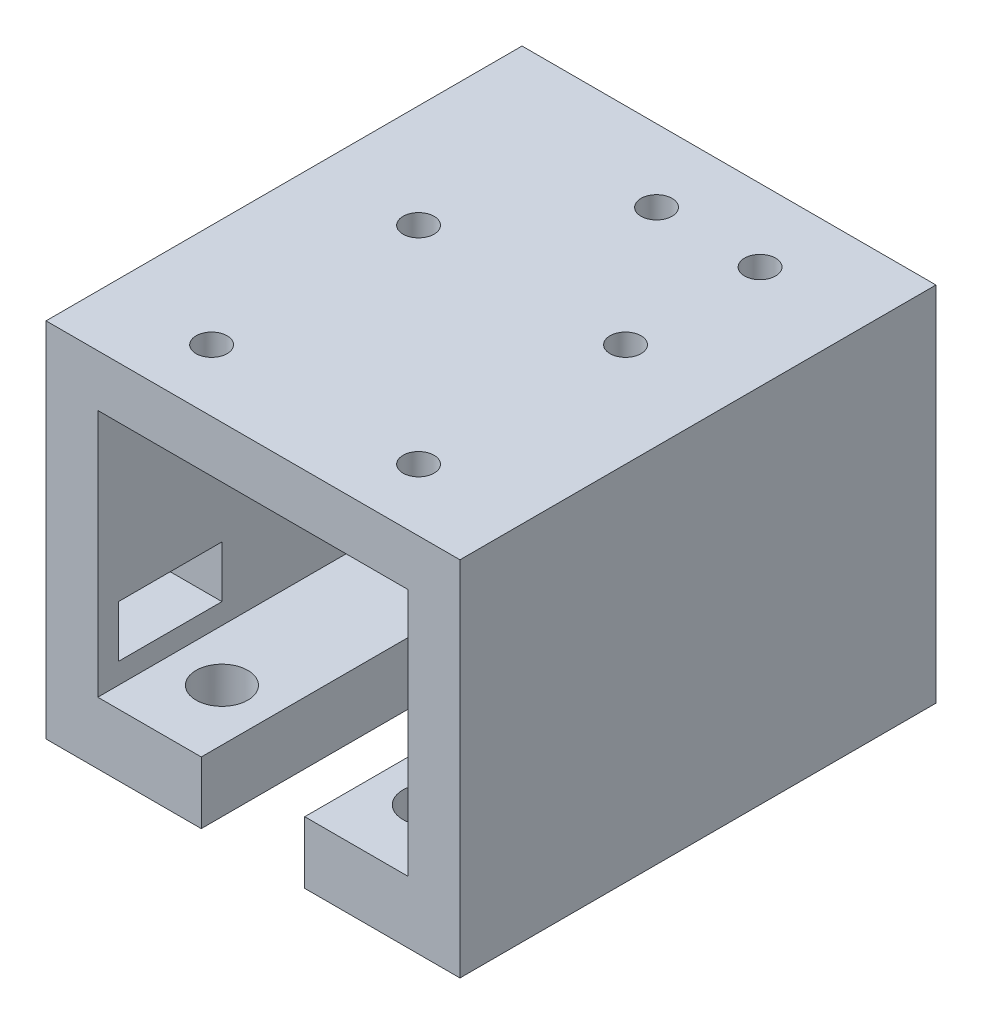
from build123d import *

# Parameters (mm, degrees)
BOSS_EXTRUDE1_DEPTH = 46
SKETCH2_R           = 2.5
CUT_EXTRUDE1_DEPTH  = 6
SKETCH3_R           = 1.5
CUT_EXTRUDE2_DEPTH  = 5
SKETCH4_R           = 1.5
CUT_EXTRUDE3_DEPTH  = 5
SKETCH5_W           = 10
SKETCH5_H           = 5
CUT_EXTRUDE4_DEPTH  = 5


with BuildPart() as part:
    # Sketch1 → Boss-Extrude1 (new body)
    with BuildSketch(Plane.XY):
        Polygon((20, 39.058190014), (-20, 39.058190014), (-20, 4.058190014), (-5, 4.058190014), (-5, 10.058190014), (-15, 10.058190014), (-15, 34.058190014), (15, 34.058190014), (15, 10.058190014), (5, 10.058190014), (5, 4.058190014), (20, 4.058190014), align=None)
    extrude(amount=BOSS_EXTRUDE1_DEPTH)

    # Sketch2 → Cut-Extrude1 (cut)
    with BuildSketch(Plane(origin=(0, 4.058190014, 0), x_dir=(-1, 0, 0), z_dir=(0, -1, 0))):
        with Locations(Location((10, -39, 0), (0, 0, 180))):
            Circle(SKETCH2_R)
        with Locations(Location((-10, -39, 0), (0, 0, 180))):
            Circle(SKETCH2_R)
        with Locations(Location((-10, -7, 0), (0, 0, 180))):
            Circle(SKETCH2_R)
        with Locations(Location((10, -7, 0), (0, 0, 180))):
            Circle(SKETCH2_R)
    extrude(amount=-CUT_EXTRUDE1_DEPTH, mode=Mode.SUBTRACT)

    # Sketch3 → Cut-Extrude2 (cut)
    with BuildSketch(Plane(origin=(0, 39.058190014, 0), x_dir=(1, 0, 0), z_dir=(0, 1, 0))):
        with Locations(Location((-10, -20, 0), (0, 0, 180))):
            Circle(SKETCH3_R)
        with Locations(Location((10, -20, 0), (0, 0, 180))):
            Circle(SKETCH3_R)
        with Locations(Location((-10, -40, 0), (0, 0, 180))):
            Circle(SKETCH3_R)
        with Locations(Location((10, -40, 0), (0, 0, 180))):
            Circle(SKETCH3_R)
    extrude(amount=-CUT_EXTRUDE2_DEPTH, mode=Mode.SUBTRACT)

    # Sketch4 → Cut-Extrude3 (cut)
    with BuildSketch(Plane(origin=(0, 39.058190014, 0), x_dir=(1, 0, 0), z_dir=(0, 1, 0))):
        with Locations(Location((10, -7, 0), (0, 0, 180))):
            Circle(SKETCH4_R)
        with Locations(Location((0, -7, 0), (0, 0, 180))):
            Circle(SKETCH4_R)
    extrude(amount=-CUT_EXTRUDE3_DEPTH, mode=Mode.SUBTRACT)

    # Sketch5 → Cut-Extrude4 (cut)
    with BuildSketch(Plane.ZY.offset(20)):
        with Locations((39, 14.558190014)):
            Rectangle(SKETCH5_W, SKETCH5_H)
    extrude(amount=-CUT_EXTRUDE4_DEPTH, mode=Mode.SUBTRACT)


solid = part.part
